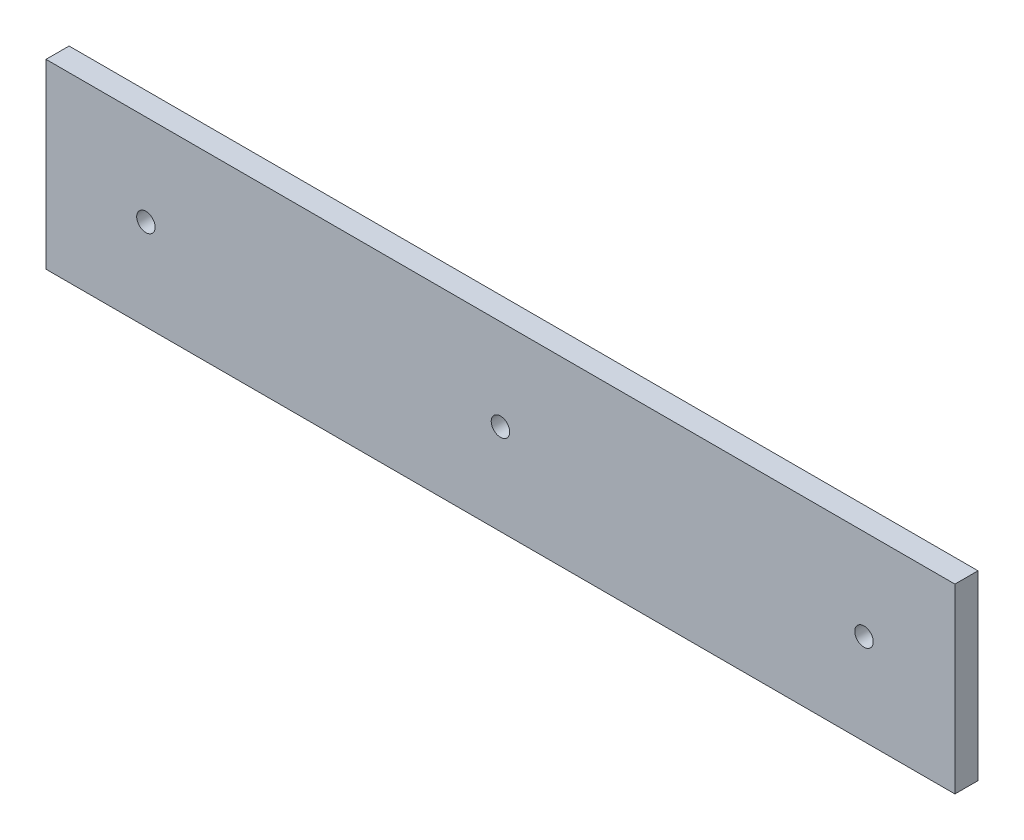
from build123d import *

# Parameters (mm, degrees)
SKETCH2_W           = 100
SKETCH2_H           = 20
SKETCH2_R           = 1.016
BOSS_EXTRUDE1_DEPTH = 2.54


with BuildPart() as part:
    # Sketch2 → Boss-Extrude1 (new body)
    with BuildSketch(Plane.XY):
        with Locations((-1.785, 62.561262502)):
            Rectangle(SKETCH2_W, SKETCH2_H)
        with Locations((-40.7925, 62.561262502)):
            Circle(SKETCH2_R, mode=Mode.SUBTRACT)
        with Locations((-1.785, 62.561262502)):
            Circle(SKETCH2_R, mode=Mode.SUBTRACT)
        with Locations((38.215, 62.561262502)):
            Circle(SKETCH2_R, mode=Mode.SUBTRACT)
    extrude(amount=BOSS_EXTRUDE1_DEPTH)


solid = part.part
